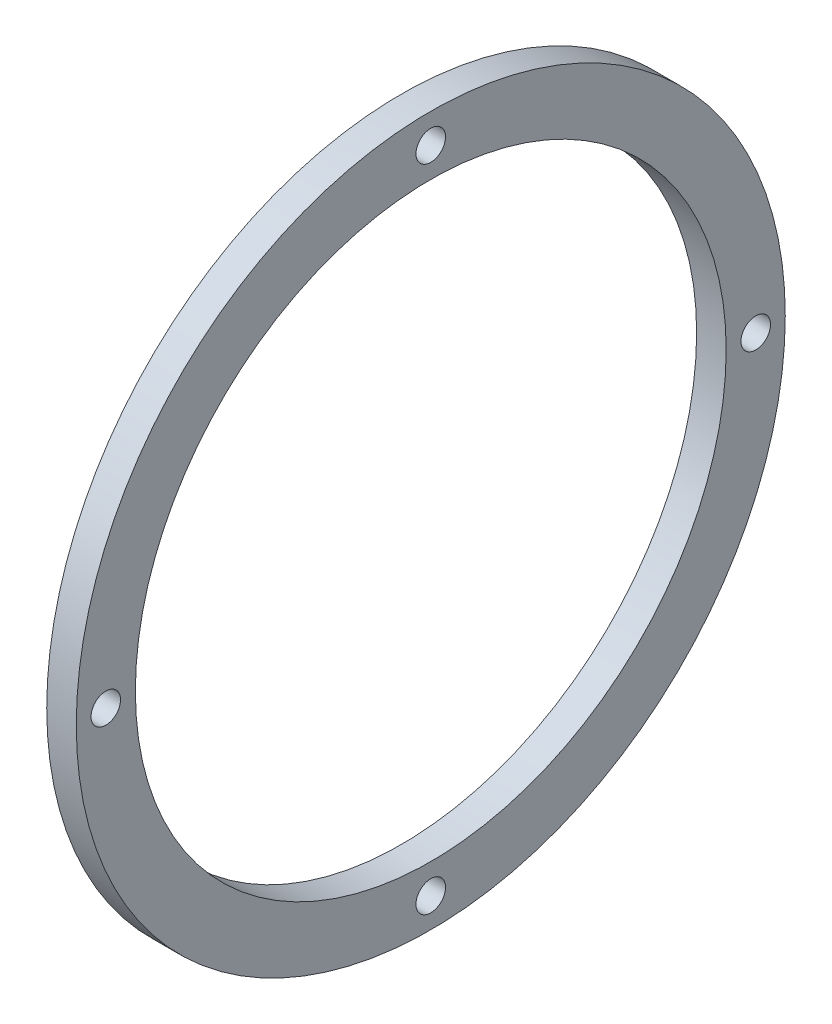
from build123d import *

# Parameters (mm, degrees)
SKETCH1_R           = 38.1
SKETCH1_R_2         = 1.5875
SKETCH1_R_3         = 31.75
BOSS_EXTRUDE1_DEPTH = 3.175


with BuildPart() as part:
    # Sketch1 → Boss-Extrude1 (new body)
    with BuildSketch(Plane(origin=(0, 0, 0), x_dir=(0, 0, -1), z_dir=(1, 0, 0))):
        Circle(SKETCH1_R)
        with Locations((34.925, 0)):
            Circle(SKETCH1_R_2, mode=Mode.SUBTRACT)
        with Locations((0, -34.925)):
            Circle(SKETCH1_R_2, mode=Mode.SUBTRACT)
        with Locations((-34.925, 0)):
            Circle(SKETCH1_R_2, mode=Mode.SUBTRACT)
        with Locations((0, 34.925)):
            Circle(SKETCH1_R_2, mode=Mode.SUBTRACT)
        Circle(SKETCH1_R_3, mode=Mode.SUBTRACT)
    extrude(amount=BOSS_EXTRUDE1_DEPTH)


solid = part.part
